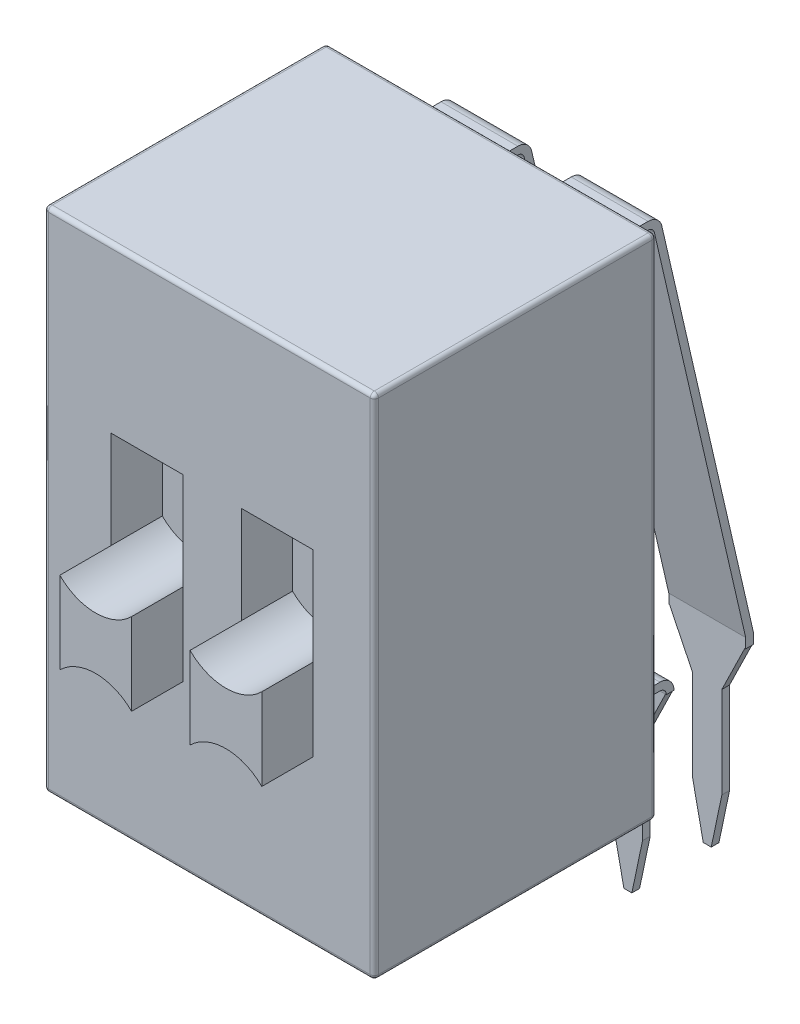
from build123d import *

# Parameters (mm, degrees)
SKETCH_1_W               = 5.5
SKETCH_1_H               = 9.9
EXTRUDE_1_DEPTH          = 6.44
SKETCH_2_W               = 1.5
SKETCH_2_H               = 0.15
PATTERN_LINEAR_1_COUNT   = 2
PATTERN_LINEAR_1_PITCH   = 2.54
SKETCH_3_W               = 1.5
SKETCH_3_H               = 0.15
PATTERN_LINEAR_2_COUNT   = 2
PATTERN_LINEAR_2_PITCH   = 2.54
CUT_EXTRUDE_1_DEPTH      = 0.15
CUT_EXTRUDE_1_DEPTH_BACK = 0.15
CUT_EXTRUDE_4_DEPTH      = 0.15
CUT_EXTRUDE_4_DEPTH_BACK = 0.15
CUT_EXTRUDE_5_DEPTH      = 0.15
CUT_EXTRUDE_5_DEPTH_BACK = 0.15
CUT_EXTRUDE_6_DEPTH      = 0.15
CUT_EXTRUDE_6_DEPTH_BACK = 0.15
SKETCH_6_W               = 1.4
SKETCH_6_H               = 3.5
CUT_EXTRUDE_1_2_DEPTH    = 1
PATTERN_LINEAR_3_COUNT   = 2
PATTERN_LINEAR_3_PITCH   = 2.54
EXTRUDE_2_DEPTH          = 2
SKETCH_8_W               = 5.49587381
SKETCH_8_H               = 0.4
EXTRUDE_3_DEPTH          = 0.4
FILLET_1_R               = 0.08


with BuildPart() as part:
    # Эскиз1 → Вытянуть1 (new body)
    with BuildSketch(Plane(origin=(0, 0, 0), x_dir=(0, 0, -1), z_dir=(1, 0, 0))):
        Rectangle(SKETCH_1_W, SKETCH_1_H)
    extrude(amount=EXTRUDE_1_DEPTH)

    # По траектории1: sweep along a curve in space
    with BuildLine() as sweep_1_path:
        Line((4.49, 3.95, -2.75), (4.49, 3.95, -3.790830974))
        ThreePointArc((4.49, 3.95, -3.790830974), (4.49, 3.906490428, -3.915373119), (4.49, 3.794892541, -3.98572751))
        Line((4.49, 3.794892541, -3.98572751), (4.49, -3.95, -5.769688961))
        Line((4.49, -3.95, -5.769688961), (4.49, -7.85, -5.769688961))
    # Эскиз2 → По траектории1 (sweep)
    with BuildSketch(Plane(origin=(0, 0, -2.75), x_dir=(-1, 0, 0), z_dir=(0, 0, -1))):
        with Locations((-4.49, 3.95)):
            Rectangle(SKETCH_2_W, SKETCH_2_H)
    sweep_1 = sweep(path=sweep_1_path.line, transition=Transition.RIGHT)

    # Линейный массив1: По траектории1 ×2
    with Locations(*[(-i * PATTERN_LINEAR_1_PITCH, 0, 0) for i in range(1, PATTERN_LINEAR_1_COUNT)]):
        add(sweep_1)

    # По траектории2: sweep along a curve in space
    with BuildLine() as sweep_2_path:
        Line((4.49, -3.95, -2.75), (4.49, -3.95, -4.02144183))
        ThreePointArc((4.49, -3.95, -4.02144183), (4.49, -4.008578644, -4.162863187), (4.49, -4.15, -4.22144183))
        Line((4.49, -4.15, -4.22144183), (4.49, -7.85, -4.22144183))
    # Эскиз3 → По траектории2 (sweep)
    with BuildSketch(Plane(origin=(0, 0, -2.75), x_dir=(-1, 0, 0), z_dir=(0, 0, -1))):
        with Locations((-4.49, -3.95)):
            Rectangle(SKETCH_3_W, SKETCH_3_H)
    sweep_2 = sweep(path=sweep_2_path.line)

    # Линейный массив2: По траектории2 ×2
    with Locations(*[(-i * PATTERN_LINEAR_2_PITCH, 0, 0) for i in range(1, PATTERN_LINEAR_2_COUNT)]):
        add(sweep_2)

    # Эскиз4 → Cut-Extrude 1 (cut, two sides: drawn at the far end of the back side and taken through both)
    with BuildSketch(Plane(origin=(0, 0, -5.844688961), x_dir=(-1, 0, 0), z_dir=(0, 0, -1)).offset(-CUT_EXTRUDE_1_DEPTH_BACK)):
        Polygon((-1.21347651, -4.143413371), (-1.665, -5.067248723), (-1.665, -6.848447142), (-1.871476359, -7.835), (-2.028523641, -7.835), (-2.235, -6.848447142), (-2.235, -5.067248723), (-2.68652349, -4.143413371), (-2.71347651, -4.156586629), (-2.265, -5.074187736), (-2.265, -6.851552858), (-2.052894917, -7.865), (-1.847105083, -7.865), (-1.635, -6.851552858), (-1.635, -5.074187736), (-1.18652349, -4.156586629), align=None)
    extrude(amount=CUT_EXTRUDE_1_DEPTH + CUT_EXTRUDE_1_DEPTH_BACK, mode=Mode.SUBTRACT)


with BuildPart() as cut_extrude_1_kept_piece:
    # of the separate pieces the step leaves, the one the design keeps (cut_extrude_1_pieces_kept)
    add(part.part.solids().sort_by_distance((0, 4.95, 2.75))[0])

    # Эскиз4<4> → Вырез-Вытянуть-Тонкостенный4 (cut, two sides: drawn at the far end of the back side and taken through both)
    with BuildSketch(Plane(origin=(0, 0, -5.844688961), x_dir=(-1, 0, 0), z_dir=(0, 0, -1)).offset(-CUT_EXTRUDE_4_DEPTH_BACK)):
        Polygon((-1.21347651, -4.143413371), (-1.665, -5.067248723), (-1.665, -6.848447142), (-1.871476359, -7.835), (-2.028523641, -7.835), (-2.235, -6.848447142), (-2.235, -5.067248723), (-2.68652349, -4.143413371), (-2.71347651, -4.156586629), (-2.265, -5.074187736), (-2.265, -6.851552858), (-2.052894917, -7.865), (-1.847105083, -7.865), (-1.635, -6.851552858), (-1.635, -5.074187736), (-1.18652349, -4.156586629), align=None)
        Polygon((-5.25347651, -4.156586629), (-4.805, -5.074187736), (-4.805, -6.851558008), (-4.592177182, -7.865), (-4.387822818, -7.865), (-4.175, -6.851558008), (-4.175, -5.074187736), (-3.72652349, -4.156586629), (-3.75347651, -4.143413371), (-4.205, -5.067248723), (-4.205, -6.848441992), (-4.412177182, -7.835), (-4.567822818, -7.835), (-4.775, -6.848441992), (-4.775, -5.067248723), (-5.22652349, -4.143413371), align=None)
    extrude(amount=CUT_EXTRUDE_4_DEPTH + CUT_EXTRUDE_4_DEPTH_BACK, mode=Mode.SUBTRACT)


with BuildPart() as cut_extrude_4_kept_piece:
    # of the separate pieces the step leaves, the one the design keeps (cut_extrude_4_pieces_kept)
    add(cut_extrude_1_kept_piece.part.solids().sort_by_distance((0, 4.95, 2.75))[0])

    # Эскиз5 → Вырез-Вытянуть-Тонкостенный5 (cut, two sides: drawn at the far end of the back side and taken through both)
    with BuildSketch(Plane.XY.offset(-4.14644183).offset(-CUT_EXTRUDE_5_DEPTH_BACK)):
        Polygon((1.18652349, -4.156586629), (1.635, -5.074187736), (1.635, -6.851552858), (1.847105083, -7.865), (2.052894917, -7.865), (2.265, -6.851552858), (2.265, -5.074187736), (2.71347651, -4.156586629), (2.68652349, -4.143413371), (2.235, -5.067248723), (2.235, -6.848447142), (2.028523641, -7.835), (1.871476359, -7.835), (1.665, -6.848447142), (1.665, -5.067248723), (1.21347651, -4.143413371), align=None)
    extrude(amount=CUT_EXTRUDE_5_DEPTH + CUT_EXTRUDE_5_DEPTH_BACK, mode=Mode.SUBTRACT)


with BuildPart() as cut_extrude_5_kept_piece:
    # of the separate pieces the step leaves, the one the design keeps (cut_extrude_5_pieces_kept)
    add(cut_extrude_4_kept_piece.part.solids().sort_by_distance((0, 4.95, 2.75))[0])

    # Эскиз5<4> → Вырез-Вытянуть-Тонкостенный6 (cut, two sides: drawn at the far end of the back side and taken through both)
    with BuildSketch(Plane.XY.offset(-4.14644183).offset(-CUT_EXTRUDE_6_DEPTH_BACK)):
        Polygon((1.18652349, -4.156586629), (1.635, -5.074187736), (1.635, -6.851552858), (1.847105083, -7.865), (2.052894917, -7.865), (2.265, -6.851552858), (2.265, -5.074187736), (2.71347651, -4.156586629), (2.68652349, -4.143413371), (2.235, -5.067248723), (2.235, -6.848447142), (2.028523641, -7.835), (1.871476359, -7.835), (1.665, -6.848447142), (1.665, -5.067248723), (1.21347651, -4.143413371), align=None)
        Polygon((5.22652349, -4.143413371), (4.775, -5.067248723), (4.775, -6.848441992), (4.567822818, -7.835), (4.412177182, -7.835), (4.205, -6.848441992), (4.205, -5.067248723), (3.75347651, -4.143413371), (3.72652349, -4.156586629), (4.175, -5.074187736), (4.175, -6.851558008), (4.387822818, -7.865), (4.592177182, -7.865), (4.805, -6.851558008), (4.805, -5.074187736), (5.25347651, -4.156586629), align=None)
    extrude(amount=CUT_EXTRUDE_6_DEPTH + CUT_EXTRUDE_6_DEPTH_BACK, mode=Mode.SUBTRACT)


with BuildPart() as cut_extrude_6_kept_piece:
    # of the separate pieces the step leaves, the one the design keeps (cut_extrude_6_pieces_kept)
    add(cut_extrude_5_kept_piece.part.solids().sort_by_distance((0, 4.95, 2.75))[0])

    # Эскиз6 → Cut-Extrude 1 2 (cut)
    with BuildSketch(Plane.XY.offset(2.75)):
        with Locations((2.004611319, 0)):
            Rectangle(SKETCH_6_W, SKETCH_6_H)
    cut_extrude_1_2 = extrude(amount=-CUT_EXTRUDE_1_2_DEPTH, mode=Mode.SUBTRACT)

    # Линейный массив3: Cut-Extrude 1 2 ×2
    with Locations(*[(i * PATTERN_LINEAR_3_PITCH, 0, 0) for i in range(1, PATTERN_LINEAR_3_COUNT)]):
        add(cut_extrude_1_2, mode=Mode.SUBTRACT)

    # Эскиз7 → Вытянуть2 (add)
    with BuildSketch(Plane.XY.offset(1.75)):
        with BuildLine():
            Line((1.304611319, -0.15), (1.304611319, -1.75))
            ThreePointArc((1.304611319, -1.75), (2.004611319, -1.460050506), (2.704611319, -1.75))
            Line((2.704611319, -1.75), (2.704611319, -0.15))
            ThreePointArc((2.704611319, -0.15), (2.004611319, -0.439949494), (1.304611319, -0.15))
        make_face()
        with BuildLine():
            Line((3.844611319, -0.15), (3.844611319, -1.75))
            ThreePointArc((3.844611319, -1.75), (4.544611319, -1.460050506), (5.244611319, -1.75))
            Line((5.244611319, -1.75), (5.244611319, -0.15))
            ThreePointArc((5.244611319, -0.15), (4.544611319, -0.439949494), (3.844611319, -0.15))
        make_face()
    extrude(amount=EXTRUDE_2_DEPTH)

    # Эскиз8 → Вытянуть3 (add)
    with BuildSketch(Plane(origin=(0, 0, -2.75), x_dir=(-1, 0, 0), z_dir=(0, 0, -1))):
        with Locations((-3.22, 2.2)):
            Rectangle(SKETCH_8_W, SKETCH_8_H)
        with Locations((-3.22, -2.2)):
            Rectangle(SKETCH_8_W, SKETCH_8_H)
    extrude(amount=EXTRUDE_3_DEPTH)

    # Скругление1
    fillet_1_edges = [cut_extrude_6_kept_piece.edges().sort_by_distance(p)[0] for p in [
        (0, 0, -2.75),
        (3.22, -4.95, -2.75),
        (0, 0, 2.75),
        (3.22, 4.95, 2.75),
        (0, -4.95, 0),
        (3.22, -4.95, 2.75),
        (0, 4.95, 0),
        (3.22, 4.95, -2.75),
        (6.44, 0, 2.75),
        (6.44, -4.95, 0),
        (6.44, 0, -2.75),
        (6.44, 4.95, 0),
    ]]
    fillet(fillet_1_edges, radius=FILLET_1_R)


solid = cut_extrude_6_kept_piece.part
